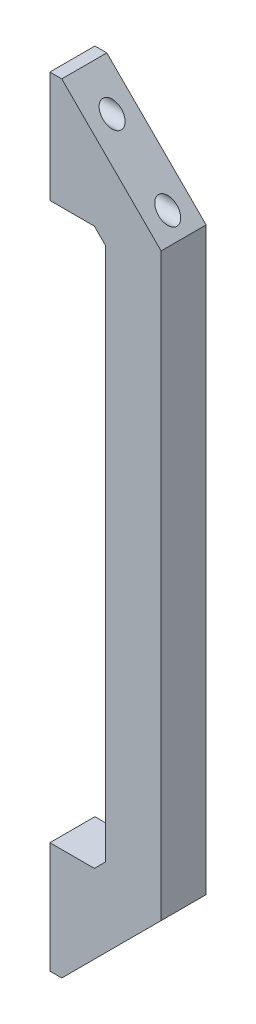
from build123d import *

# Parameters (mm, degrees)
BOSS_EXTRU_1_DEPTH      = 8.1
ESQUISSE2_R             = 1.65
ENL_V_MAT_EXTRU_1_DEPTH = 142.653132687


with BuildPart() as part:
    # Esquisse1 → Boss.-Extru.1 (new body)
    with BuildSketch(Plane.XY):
        Polygon((0, 0), (0, 20), (8, 20), (10, 22), (10, 118), (8, 120), (0, 120), (0, 140), (2.142135624, 140), (20, 122.142135624), (20, 17.857864376), (2.142135624, 0), align=None)
    extrude(amount=BOSS_EXTRU_1_DEPTH)

    # Esquisse2 → Enlèv. mat.-Extru.1 (cut, through all)
    with BuildSketch(Plane.ZY):
        with Locations((4.05, 15)):
            Circle(ESQUISSE2_R)
        with Locations(Location((4.05, 5, 0), (0, 0, 270))):
            Circle(ESQUISSE2_R)
        with Locations((4.05, 135)):
            Circle(ESQUISSE2_R)
        with Locations(Location((4.05, 125, 0), (0, 0, 90))):
            Circle(ESQUISSE2_R)
    extrude(amount=-ENL_V_MAT_EXTRU_1_DEPTH, mode=Mode.SUBTRACT)


solid = part.part
